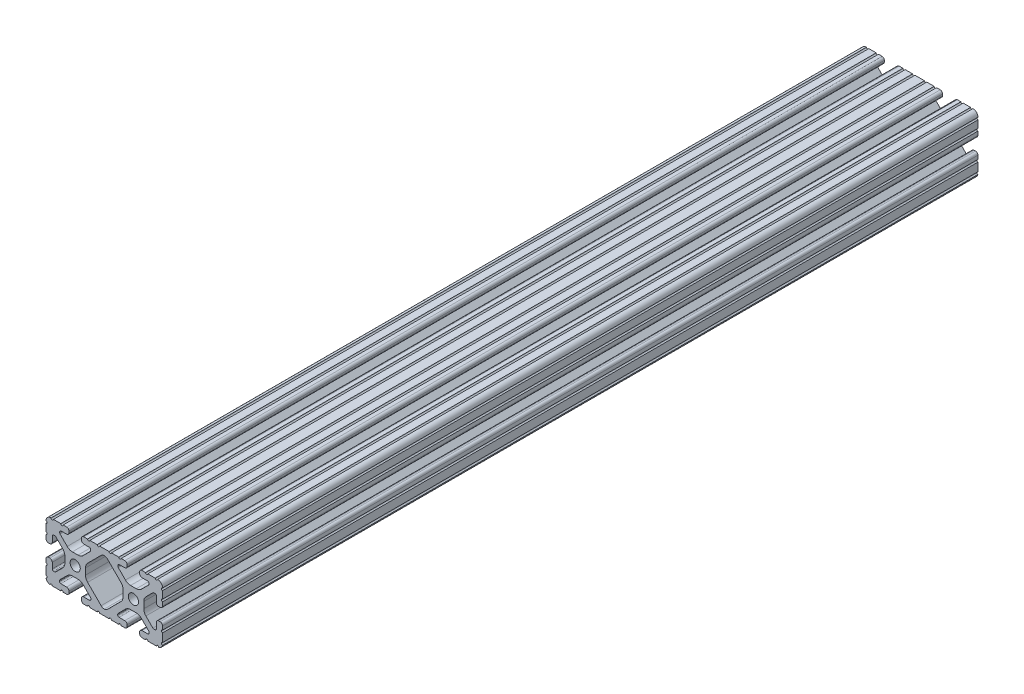
from build123d import *

# Parameters (mm, degrees)
SKETCH1_R      = 3.3274
EXTRUDE1_DEPTH = 533.4


with BuildPart() as part:
    # Sketch1 → Extrude1 (new body)
    with BuildSketch(Plane.XY):
        with BuildLine():
            Line((-3.121121376, -19.05), (3.121121376, -19.05))
            ThreePointArc((3.121121376, -19.05), (3.883121376, -18.288), (4.645121376, -19.05))
            Line((4.645121376, -19.05), (8.633115796, -19.05))
            Line((8.633115796, -19.05), (9.473536067, -19.05))
            ThreePointArc((9.473536067, -19.05), (10.235536067, -18.288), (10.997536067, -19.05))
            Line((10.997536067, -19.05), (13.4112, -19.05))
            ThreePointArc((13.4112, -19.05), (14.524751759, -18.588751759), (14.986, -17.4752))
            Line((14.986, -17.4752), (14.986, -16.5608))
            ThreePointArc((14.986, -16.5608), (14.524751759, -15.447248241), (13.4112, -14.986))
            Line((13.4112, -14.986), (9.652, -14.986))
            ThreePointArc((9.652, -14.986), (9.023382072, -14.725617928), (8.763, -14.097))
            Line((8.763, -14.097), (8.763, -13.687179678))
            ThreePointArc((8.763, -13.687179678), (8.830670671, -13.346975131), (9.023380503, -13.058563318))
            Line((9.023380503, -13.058563318), (13.852498595, -8.229421131))
            ThreePointArc((13.852498595, -8.229421131), (15.393447522, -7.199787805), (17.211122763, -6.838228541))
            Line((17.211122763, -6.838228541), (20.888877237, -6.838228541))
            ThreePointArc((20.888877237, -6.838228541), (22.706552478, -7.199787805), (24.247501405, -8.229421131))
            Line((24.247501405, -8.229421131), (29.076619497, -13.058563318))
            ThreePointArc((29.076619497, -13.058563318), (29.269329329, -13.346975131), (29.337, -13.687179678))
            Line((29.337, -13.687179678), (29.337, -14.097))
            ThreePointArc((29.337, -14.097), (29.076617928, -14.725617928), (28.448, -14.986))
            Line((28.448, -14.986), (24.6888, -14.986))
            ThreePointArc((24.6888, -14.986), (23.575248241, -15.447248241), (23.114, -16.5608))
            Line((23.114, -16.5608), (23.114, -17.4752))
            ThreePointArc((23.114, -17.4752), (23.575248241, -18.588751759), (24.6888, -19.05))
            Line((24.6888, -19.05), (26.945817469, -19.05))
            ThreePointArc((26.945817469, -19.05), (27.707817469, -18.288), (28.469817469, -19.05))
            Line((28.469817469, -19.05), (29.207115796, -19.05))
            Line((29.207115796, -19.05), (34.047273398, -19.05))
            ThreePointArc((34.047273398, -19.05), (34.809273398, -18.288), (35.571273398, -19.05))
            ThreePointArc((35.571273398, -19.05), (37.207577603, -18.182738167), (38.1, -16.560019212))
            ThreePointArc((38.1, -16.560019212), (37.338, -15.798019212), (38.1, -15.036019212))
            Line((38.1, -15.036019212), (38.1, -10.287))
            Line((38.1, -10.287), (38.1, -9.549701672))
            ThreePointArc((38.1, -9.549701672), (37.338, -8.787701672), (38.1, -8.025701672))
            Line((38.1, -8.025701672), (38.1, -5.6388))
            ThreePointArc((38.1, -5.6388), (37.638751759, -4.525248241), (36.5252, -4.064))
            Line((36.5252, -4.064), (35.6108, -4.064))
            ThreePointArc((35.6108, -4.064), (34.497248241, -4.525248241), (34.036, -5.6388))
            Line((34.036, -5.6388), (34.036, -9.398))
            ThreePointArc((34.036, -9.398), (33.775617928, -10.026617928), (33.147, -10.287))
            Line((33.147, -10.287), (32.420656743, -10.287))
            ThreePointArc((32.420656743, -10.287), (32.080450147, -10.21932848), (31.792037247, -10.02661636))
            Line((31.792037247, -10.02661636), (27.197575832, -5.43213202))
            ThreePointArc((27.197575832, -5.43213202), (26.167954729, -3.891188903), (25.8064, -2.07352461))
            Line((25.8064, -2.07352461), (25.8064, 2.07352461))
            ThreePointArc((25.8064, 2.07352461), (26.167954729, 3.891188903), (27.197575832, 5.43213202))
            Line((27.197575832, 5.43213202), (31.792037247, 10.02661636))
            ThreePointArc((31.792037247, 10.02661636), (32.080450147, 10.21932848), (32.420656743, 10.287))
            Line((32.420656743, 10.287), (33.147, 10.287))
            ThreePointArc((33.147, 10.287), (33.775617928, 10.026617928), (34.036, 9.398))
            Line((34.036, 9.398), (34.036, 5.6388))
            ThreePointArc((34.036, 5.6388), (34.497248241, 4.525248241), (35.6108, 4.064))
            Line((35.6108, 4.064), (36.5252, 4.064))
            ThreePointArc((36.5252, 4.064), (37.638751759, 4.525248241), (38.1, 5.6388))
            Line((38.1, 5.6388), (38.1, 8.025701672))
            ThreePointArc((38.1, 8.025701672), (37.338, 8.787701672), (38.1, 9.549701672))
            Line((38.1, 9.549701672), (38.1, 10.287))
            Line((38.1, 10.287), (38.1, 14.375206214))
            ThreePointArc((38.1, 14.375206214), (37.338232276, 15.156019383), (38.137614868, 15.89827725))
            ThreePointArc((38.137614868, 15.89827725), (37.148019028, 18.192014021), (34.819536496, 19.096833012))
            ThreePointArc((34.819536496, 19.096833012), (34.081312886, 18.311776389), (33.296256263, 19.05))
            Line((33.296256263, 19.05), (29.207115796, 19.05))
            Line((29.207115796, 19.05), (28.469817468, 19.05))
            ThreePointArc((28.469817468, 19.05), (27.707817468, 18.288), (26.945817468, 19.05))
            Line((26.945817468, 19.05), (24.558915796, 19.05))
            ThreePointArc((24.558915796, 19.05), (23.53023695, 18.547208069), (23.114, 17.480565346))
            Line((23.114, 17.480565346), (23.114, 16.5608))
            ThreePointArc((23.114, 16.5608), (23.575248241, 15.447248241), (24.6888, 14.986))
            Line((24.6888, 14.986), (28.295243665, 14.986))
            ThreePointArc((28.295243665, 14.986), (28.923861593, 14.725617928), (29.184243665, 14.097))
            Line((29.184243665, 14.097), (29.184243665, 13.53442258))
            ThreePointArc((29.184243665, 13.53442258), (29.116572993, 13.194218033), (28.923863161, 12.90580622))
            Line((28.923863161, 12.90580622), (24.247501405, 8.229421131))
            ThreePointArc((24.247501405, 8.229421131), (22.706552478, 7.199787805), (20.888877237, 6.838228541))
            Line((20.888877237, 6.838228541), (17.211122763, 6.838228541))
            ThreePointArc((17.211122763, 6.838228541), (15.393447522, 7.199787805), (13.852498595, 8.229421131))
            Line((13.852498595, 8.229421131), (9.176136839, 12.90580622))
            ThreePointArc((9.176136839, 12.90580622), (8.983427007, 13.194218033), (8.915756335, 13.53442258))
            Line((8.915756335, 13.53442258), (8.915756335, 14.097))
            ThreePointArc((8.915756335, 14.097), (9.176138407, 14.725617928), (9.804756335, 14.986))
            Line((9.804756335, 14.986), (13.4112, 14.986))
            ThreePointArc((13.4112, 14.986), (14.524751759, 15.447248241), (14.986, 16.5608))
            Line((14.986, 16.5608), (14.986, 17.496772581))
            ThreePointArc((14.986, 17.496772581), (14.531070222, 18.595070222), (13.432772581, 19.05))
            Line((13.432772581, 19.05), (10.997536067, 19.05))
            ThreePointArc((10.997536067, 19.05), (10.235536067, 18.288), (9.473536067, 19.05))
            Line((9.473536067, 19.05), (8.633115796, 19.05))
            Line((8.633115796, 19.05), (4.645121376, 19.05))
            ThreePointArc((4.645121376, 19.05), (3.883121376, 18.288), (3.121121376, 19.05))
            Line((3.121121376, 19.05), (-3.121121376, 19.05))
            ThreePointArc((-3.121121376, 19.05), (-3.883121376, 18.288), (-4.645121376, 19.05))
            Line((-4.645121376, 19.05), (-8.633115796, 19.05))
            Line((-8.633115796, 19.05), (-9.473536067, 19.05))
            ThreePointArc((-9.473536067, 19.05), (-10.235536067, 18.288), (-10.997536067, 19.05))
            Line((-10.997536067, 19.05), (-13.432772581, 19.05))
            ThreePointArc((-13.432772581, 19.05), (-14.531070222, 18.595070222), (-14.986, 17.496772581))
            Line((-14.986, 17.496772581), (-14.986, 16.5608))
            ThreePointArc((-14.986, 16.5608), (-14.524751759, 15.447248241), (-13.4112, 14.986))
            Line((-13.4112, 14.986), (-9.804756335, 14.986))
            ThreePointArc((-9.804756335, 14.986), (-9.176138407, 14.725617928), (-8.915756335, 14.097))
            Line((-8.915756335, 14.097), (-8.915756335, 13.53442258))
            ThreePointArc((-8.915756335, 13.53442258), (-8.983427007, 13.194218033), (-9.176136839, 12.90580622))
            Line((-9.176136839, 12.90580622), (-13.852498595, 8.229421131))
            ThreePointArc((-13.852498595, 8.229421131), (-15.393447522, 7.199787805), (-17.211122763, 6.838228541))
            Line((-17.211122763, 6.838228541), (-20.888877237, 6.838228541))
            ThreePointArc((-20.888877237, 6.838228541), (-22.706552478, 7.199787805), (-24.247501405, 8.229421131))
            Line((-24.247501405, 8.229421131), (-28.923863161, 12.90580622))
            ThreePointArc((-28.923863161, 12.90580622), (-29.116572993, 13.194218033), (-29.184243665, 13.53442258))
            Line((-29.184243665, 13.53442258), (-29.184243665, 14.097))
            ThreePointArc((-29.184243665, 14.097), (-28.923861593, 14.725617928), (-28.295243665, 14.986))
            Line((-28.295243665, 14.986), (-24.6888, 14.986))
            ThreePointArc((-24.6888, 14.986), (-23.575248241, 15.447248241), (-23.114, 16.5608))
            Line((-23.114, 16.5608), (-23.114, 17.480565346))
            ThreePointArc((-23.114, 17.480565346), (-23.53023695, 18.547208069), (-24.558915796, 19.05))
            Line((-24.558915796, 19.05), (-26.945817468, 19.05))
            ThreePointArc((-26.945817468, 19.05), (-27.707817468, 18.288), (-28.469817468, 19.05))
            Line((-28.469817468, 19.05), (-29.207115796, 19.05))
            Line((-29.207115796, 19.05), (-33.296256263, 19.05))
            ThreePointArc((-33.296256263, 19.05), (-34.081312886, 18.311776389), (-34.819536496, 19.096833012))
            ThreePointArc((-34.819536496, 19.096833012), (-37.148019028, 18.192014021), (-38.137614868, 15.89827725))
            ThreePointArc((-38.137614868, 15.89827725), (-37.338232276, 15.156019383), (-38.1, 14.375206214))
            Line((-38.1, 14.375206214), (-38.1, 10.287))
            Line((-38.1, 10.287), (-38.1, 9.549701672))
            ThreePointArc((-38.1, 9.549701672), (-37.338, 8.787701672), (-38.1, 8.025701672))
            Line((-38.1, 8.025701672), (-38.1, 5.6388))
            ThreePointArc((-38.1, 5.6388), (-37.638751759, 4.525248241), (-36.5252, 4.064))
            Line((-36.5252, 4.064), (-35.6108, 4.064))
            ThreePointArc((-35.6108, 4.064), (-34.497248241, 4.525248241), (-34.036, 5.6388))
            Line((-34.036, 5.6388), (-34.036, 9.398))
            ThreePointArc((-34.036, 9.398), (-33.775617928, 10.026617928), (-33.147, 10.287))
            Line((-33.147, 10.287), (-32.420656743, 10.287))
            ThreePointArc((-32.420656743, 10.287), (-32.080450147, 10.21932848), (-31.792037247, 10.02661636))
            Line((-31.792037247, 10.02661636), (-27.197575832, 5.43213202))
            ThreePointArc((-27.197575832, 5.43213202), (-26.167954729, 3.891188903), (-25.8064, 2.07352461))
            Line((-25.8064, 2.07352461), (-25.8064, -2.07352461))
            ThreePointArc((-25.8064, -2.07352461), (-26.167954729, -3.891188903), (-27.197575832, -5.43213202))
            Line((-27.197575832, -5.43213202), (-31.792037247, -10.02661636))
            ThreePointArc((-31.792037247, -10.02661636), (-32.080450147, -10.21932848), (-32.420656743, -10.287))
            Line((-32.420656743, -10.287), (-33.147, -10.287))
            ThreePointArc((-33.147, -10.287), (-33.775617928, -10.026617928), (-34.036, -9.398))
            Line((-34.036, -9.398), (-34.036, -5.6388))
            ThreePointArc((-34.036, -5.6388), (-34.497248241, -4.525248241), (-35.6108, -4.064))
            Line((-35.6108, -4.064), (-36.5252, -4.064))
            ThreePointArc((-36.5252, -4.064), (-37.638751759, -4.525248241), (-38.1, -5.6388))
            Line((-38.1, -5.6388), (-38.1, -8.025701672))
            ThreePointArc((-38.1, -8.025701672), (-37.338, -8.787701672), (-38.1, -9.549701672))
            Line((-38.1, -9.549701672), (-38.1, -10.287))
            Line((-38.1, -10.287), (-38.1, -15.036019212))
            ThreePointArc((-38.1, -15.036019212), (-37.338, -15.798019212), (-38.1, -16.560019212))
            ThreePointArc((-38.1, -16.560019212), (-37.20882252, -18.184002456), (-35.571273398, -19.05))
            ThreePointArc((-35.571273398, -19.05), (-34.809273398, -18.288), (-34.047273398, -19.05))
            Line((-34.047273398, -19.05), (-29.207115796, -19.05))
            Line((-29.207115796, -19.05), (-28.469817469, -19.05))
            ThreePointArc((-28.469817469, -19.05), (-27.707817469, -18.288), (-26.945817469, -19.05))
            Line((-26.945817469, -19.05), (-24.6888, -19.05))
            ThreePointArc((-24.6888, -19.05), (-23.575248241, -18.588751759), (-23.114, -17.4752))
            Line((-23.114, -17.4752), (-23.114, -16.5608))
            ThreePointArc((-23.114, -16.5608), (-23.575248241, -15.447248241), (-24.6888, -14.986))
            Line((-24.6888, -14.986), (-28.448, -14.986))
            ThreePointArc((-28.448, -14.986), (-29.076617928, -14.725617928), (-29.337, -14.097))
            Line((-29.337, -14.097), (-29.337, -13.687179678))
            ThreePointArc((-29.337, -13.687179678), (-29.269329329, -13.346975131), (-29.076619497, -13.058563318))
            Line((-29.076619497, -13.058563318), (-24.247501405, -8.229421131))
            ThreePointArc((-24.247501405, -8.229421131), (-22.706552478, -7.199787805), (-20.888877237, -6.838228541))
            Line((-20.888877237, -6.838228541), (-17.211122763, -6.838228541))
            ThreePointArc((-17.211122763, -6.838228541), (-15.393447522, -7.199787805), (-13.852498595, -8.229421131))
            Line((-13.852498595, -8.229421131), (-9.023380503, -13.058563318))
            ThreePointArc((-9.023380503, -13.058563318), (-8.830670671, -13.346975131), (-8.763, -13.687179678))
            Line((-8.763, -13.687179678), (-8.763, -14.097))
            ThreePointArc((-8.763, -14.097), (-9.023382072, -14.725617928), (-9.652, -14.986))
            Line((-9.652, -14.986), (-13.4112, -14.986))
            ThreePointArc((-13.4112, -14.986), (-14.524751759, -15.447248241), (-14.986, -16.5608))
            Line((-14.986, -16.5608), (-14.986, -17.4752))
            ThreePointArc((-14.986, -17.4752), (-14.524751759, -18.588751759), (-13.4112, -19.05))
            Line((-13.4112, -19.05), (-10.997536067, -19.05))
            ThreePointArc((-10.997536067, -19.05), (-10.235536067, -18.288), (-9.473536067, -19.05))
            Line((-9.473536067, -19.05), (-8.633115796, -19.05))
            Line((-8.633115796, -19.05), (-4.645121376, -19.05))
            ThreePointArc((-4.645121376, -19.05), (-3.883121376, -18.288), (-3.121121376, -19.05))
        make_face()
        with Locations((19.05, 0)):
            Circle(SKETCH1_R, mode=Mode.SUBTRACT)
        with Locations(Location((-19.05, 0, 0), (0, 0, 180))):
            Circle(SKETCH1_R, mode=Mode.SUBTRACT)
        with BuildLine():
            Line((2.077035361, 14.257564863), (10.902424168, 5.43213202))
            ThreePointArc((10.902424168, 5.43213202), (11.932045271, 3.891188903), (12.2936, 2.07352461))
            Line((12.2936, 2.07352461), (12.2936, -2.07352461))
            ThreePointArc((12.2936, -2.07352461), (11.932045271, -3.891188903), (10.902424168, -5.43213202))
            Line((10.902424168, -5.43213202), (2.077035361, -14.257564863))
            ThreePointArc((2.077035361, -14.257564863), (1.124045601, -14.892973012), (0, -15.113096807))
            ThreePointArc((0, -15.113096807), (-1.124045601, -14.892973012), (-2.077035361, -14.257564863))
            Line((-2.077035361, -14.257564863), (-10.902424168, -5.43213202))
            ThreePointArc((-10.902424168, -5.43213202), (-11.932045271, -3.891188903), (-12.2936, -2.07352461))
            Line((-12.2936, -2.07352461), (-12.2936, 2.07352461))
            ThreePointArc((-12.2936, 2.07352461), (-11.932045271, 3.891188903), (-10.902424168, 5.43213202))
            Line((-10.902424168, 5.43213202), (-2.077035361, 14.257564863))
            ThreePointArc((-2.077035361, 14.257564863), (-1.124045601, 14.892973012), (0, 15.113096807))
            ThreePointArc((0, 15.113096807), (1.124045601, 14.892973012), (2.077035361, 14.257564863))
        make_face(mode=Mode.SUBTRACT)
    extrude(amount=-EXTRUDE1_DEPTH)


solid = part.part
